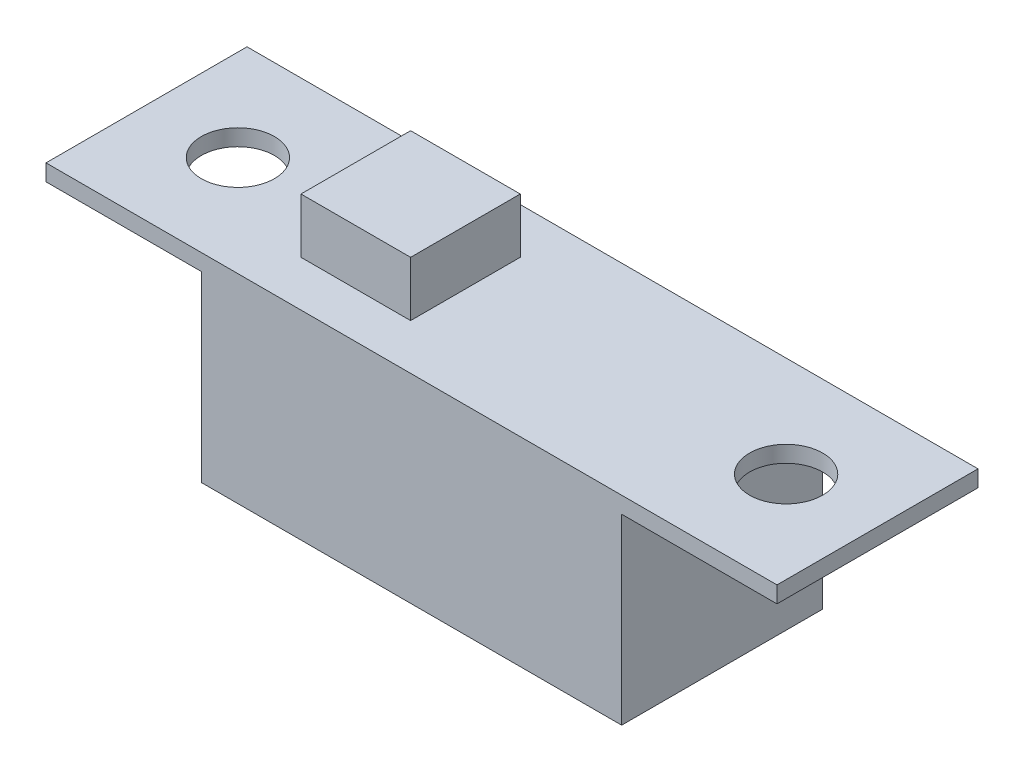
from build123d import *

# Parameters (mm, degrees)
CROQUIS1_W              = 20
CROQUIS1_H              = 5.5
CROQUIS1_R              = 1
SALIENTE_EXTRUIR1_DEPTH = 0.45
CROQUIS2_W              = 11.5
CROQUIS2_H              = 5.5
SALIENTE_EXTRUIR2_DEPTH = 5
CROQUIS3_W              = 3
CROQUIS3_H              = 3
SALIENTE_EXTRUIR3_DEPTH = 1.5


with BuildPart() as part:
    # Croquis1 → Saliente-Extruir1 (new body)
    with BuildSketch(Plane(origin=(0, 0, 0), x_dir=(1, 0, 0), z_dir=(0, 1, 0))):
        Rectangle(CROQUIS1_W, CROQUIS1_H)
        with Locations(Location((-7.5, 0, 0), (0, 0, 270))):
            Circle(CROQUIS1_R, mode=Mode.SUBTRACT)
        with Locations(Location((7.5, 0, 0), (0, 0, 270))):
            Circle(CROQUIS1_R, mode=Mode.SUBTRACT)
    extrude(amount=SALIENTE_EXTRUIR1_DEPTH)

    # Croquis2 → Saliente-Extruir2 (add)
    with BuildSketch(Plane.XZ):
        Rectangle(CROQUIS2_W, CROQUIS2_H)
    extrude(amount=SALIENTE_EXTRUIR2_DEPTH)

    # Croquis3 → Saliente-Extruir3 (add)
    with BuildSketch(Plane(origin=(0, 0.45, 0), x_dir=(1, 0, 0), z_dir=(0, 1, 0))):
        with Locations((-2.774167271, 0)):
            Rectangle(CROQUIS3_W, CROQUIS3_H)
    extrude(amount=SALIENTE_EXTRUIR3_DEPTH)


solid = part.part
